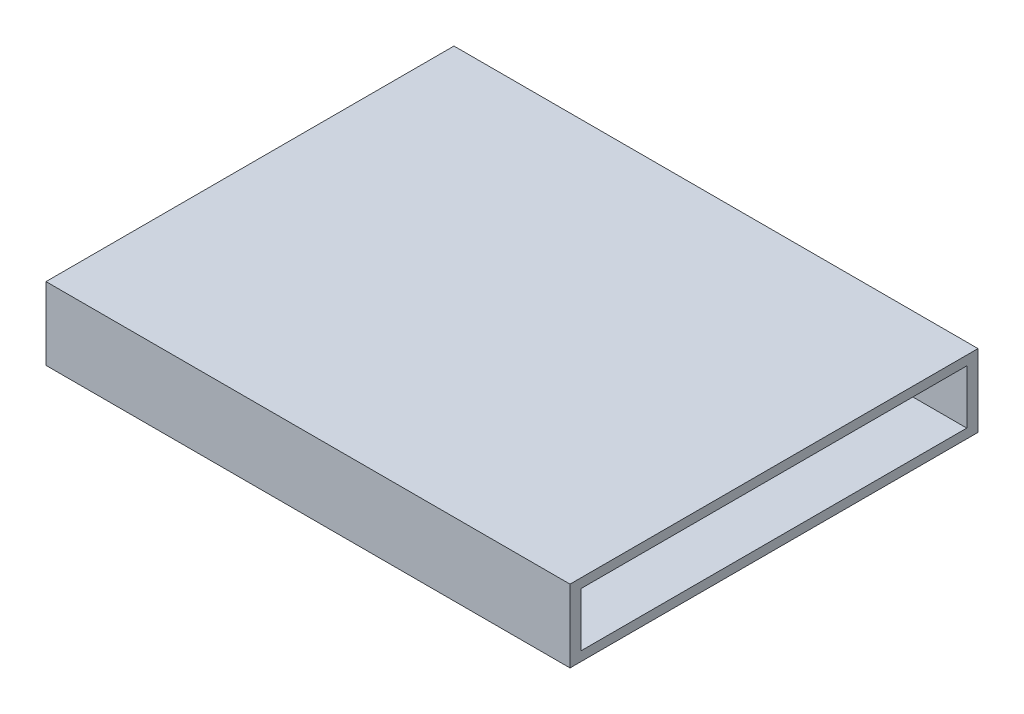
from build123d import *

# Parameters (mm, degrees)
SKETCH2_W           = 17.78
SKETCH2_H           = 13.843
BOSS_EXTRUDE1_DEPTH = 2.4638
SKETCH3_W           = 13.081
SKETCH3_H           = 1.8288
CUT_EXTRUDE1_DEPTH  = 17.3736


with BuildPart() as part:
    # Sketch2 → Boss-Extrude1 (new body)
    with BuildSketch(Plane(origin=(0, 0, 0), x_dir=(1, 0, 0), z_dir=(0, 1, 0))):
        with Locations((8.89, 6.9215)):
            Rectangle(SKETCH2_W, SKETCH2_H)
    extrude(amount=BOSS_EXTRUDE1_DEPTH)

    # Sketch3 → Cut-Extrude1 (cut)
    with BuildSketch(Plane(origin=(17.78, 0, 0), x_dir=(0, 0, -1), z_dir=(1, 0, 0))):
        with Locations((6.9215, 1.2319)):
            Rectangle(SKETCH3_W, SKETCH3_H)
    extrude(amount=-CUT_EXTRUDE1_DEPTH, mode=Mode.SUBTRACT)


solid = part.part
